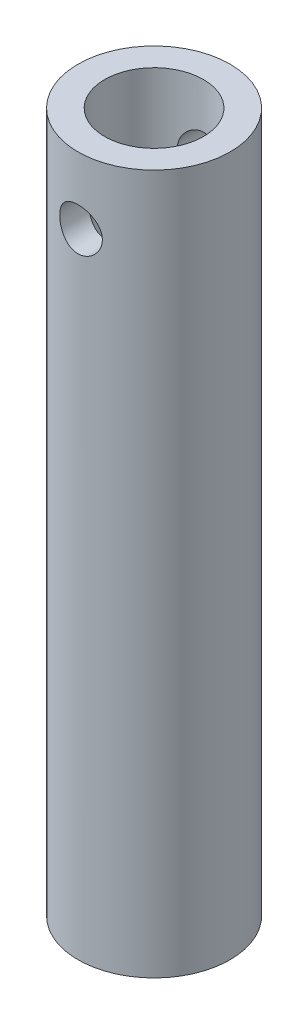
from build123d import *

# Parameters (mm, degrees)
CUT_EXTRUDE1_DEPTH      = 10
CUT_EXTRUDE1_DEPTH_BACK = 10
SKETCH2_R               = 1.4


with BuildPart() as part:
    # Sketch1 → Revolve1 (revolve)
    with BuildSketch(Plane.XY):
        Polygon((2.15, 0), (5, 0), (5, 46), (3.25, 46), (3.25, 12), (2.15, 12), align=None)
    revolve(axis=Axis((0, 0, 0), (0, 1, 0)))

    # Sketch2 → Cut-Extrude1 (cut, two sides: drawn at the far end of the back side and taken through both)
    with BuildSketch(Plane.XY.offset(-CUT_EXTRUDE1_DEPTH_BACK)):
        with Locations((0, 41.6)):
            Circle(SKETCH2_R)
    extrude(amount=CUT_EXTRUDE1_DEPTH + CUT_EXTRUDE1_DEPTH_BACK, mode=Mode.SUBTRACT)


solid = part.part
